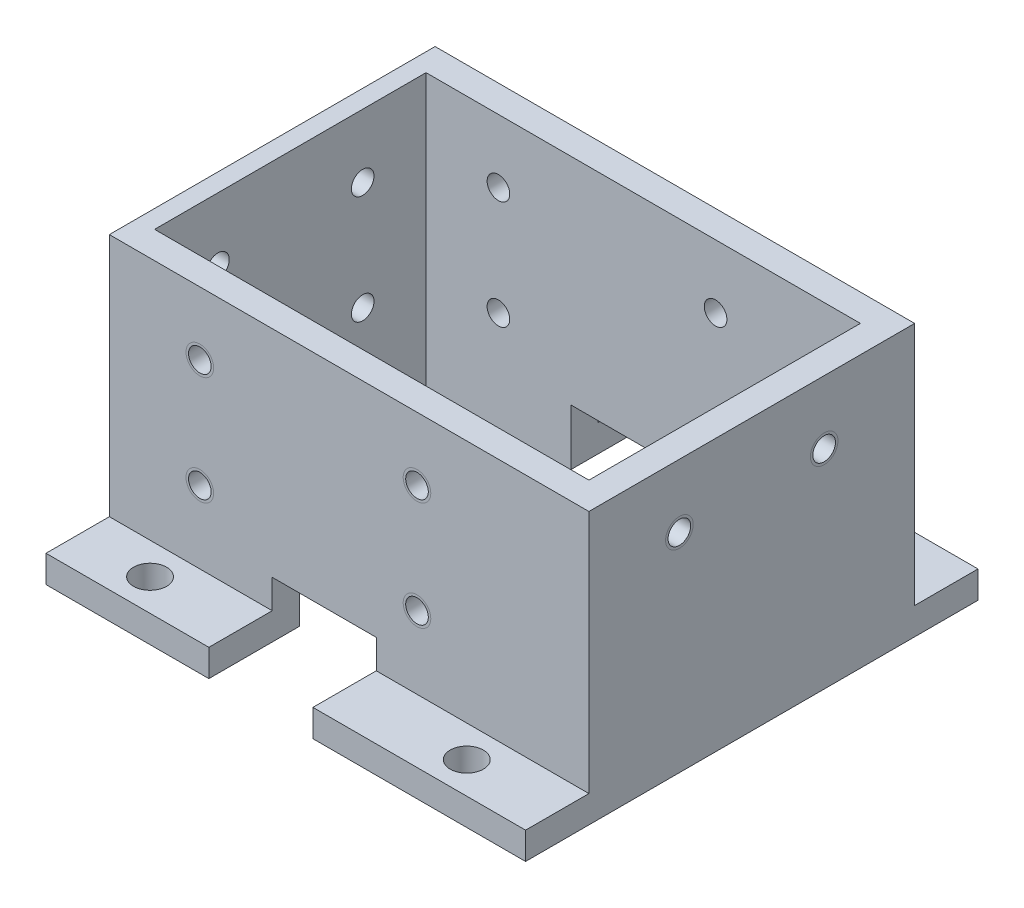
from build123d import *

# Parameters (mm, degrees)
SKETCH1_W                   = 36
SKETCH1_H                   = 38
BOSS_EXTRUDE2_DEPTH         = 53
SKETCH3_W                   = 30
SKETCH3_H                   = 35
CUT_EXTRUDE1_DEPTH          = 51
SKETCH4_W                   = 3
SKETCH4_H                   = 30
BOSS_EXTRUDE3_DEPTH         = 33
SKETCH5_W                   = 53
SKETCH5_H                   = 8
CUT_EXTRUDE2_DEPTH          = 52
SKETCH6_W                   = 53
SKETCH6_H                   = 7
BOSS_EXTRUDE4_DEPTH         = 3
CUT_EXTRUDE4_DEPTH          = 79.797208072
CUT_EXTRUDE4_DEPTH_BACK     = 79.797208072
SKETCH8_W                   = 11.5
SKETCH8_H                   = 3
M3_TAPPED_HOLE1_D           = 2.5
M3_TAPPED_HOLE1_DEPTH       = 3
M3_TAPPED_HOLE1_CSINK_D     = 3.05
M3_TAPPED_HOLE1_CSINK_ANGLE = 179
LPATTERN1_COUNT             = 2
LPATTERN1_PITCH             = 24
LPATTERN1_COUNT_DIR2        = 2
LPATTERN1_PITCH_DIR2        = 12
M3_TAPPED_HOLE2_D           = 2.5
M3_TAPPED_HOLE2_DEPTH       = 2
M3_TAPPED_HOLE2_CSINK_D     = 3.05
M3_TAPPED_HOLE2_CSINK_ANGLE = 179
LPATTERN2_COUNT             = 2
LPATTERN2_PITCH             = 16
LPATTERN2_COUNT_DIR2        = 2
LPATTERN2_PITCH_DIR2        = 12
M3_TAPPED_HOLE3_D           = 2.5
M3_TAPPED_HOLE3_CSINK_D     = 3.05
M3_TAPPED_HOLE3_CSINK_ANGLE = 179
LPATTERN3_COUNT             = 2
LPATTERN3_PITCH             = 16
M3_TAPPED_HOLE4_D           = 2.5
M3_TAPPED_HOLE4_CSINK_D     = 3.05
M3_TAPPED_HOLE4_CSINK_ANGLE = 179
LPATTERN4_COUNT             = 2
LPATTERN4_PITCH             = 24
LPATTERN4_COUNT_DIR2        = 2
LPATTERN4_PITCH_DIR2        = 12
SKETCH45_R                  = 1.833333333
CUT_EXTRUDE5_DEPTH          = 74.396185187
LPATTERN5_COUNT             = 2
LPATTERN5_PITCH             = 35
LPATTERN5_COUNT_DIR2        = 2
LPATTERN5_PITCH_DIR2        = 43
CUT_EXTRUDE6_DEPTH          = 75.551995278
CUT_EXTRUDE6_DEPTH_BACK     = 75.551995278
SKETCH46_W                  = 11.5
SKETCH46_H                  = 3.2


with BuildPart() as part:
    # Sketch1 → Boss-Extrude2 (new body)
    with BuildSketch(Plane(origin=(0, 0, 0), x_dir=(0, 0, -1), z_dir=(1, 0, 0))):
        with Locations((18, 19)):
            Rectangle(SKETCH1_W, SKETCH1_H)
    extrude(amount=BOSS_EXTRUDE2_DEPTH)

    # Sketch3 → Cut-Extrude1 (cut)
    with BuildSketch(Plane(origin=(53, 0, 0), x_dir=(0, 0, -1), z_dir=(1, 0, 0))):
        with Locations((18, 17.5)):
            Rectangle(SKETCH3_W, SKETCH3_H)
    extrude(amount=-CUT_EXTRUDE1_DEPTH, mode=Mode.SUBTRACT)

    # Sketch4 → Boss-Extrude3 (add)
    with BuildSketch(Plane.XY):
        with Locations((51.5, 15)):
            Rectangle(SKETCH4_W, SKETCH4_H)
    extrude(amount=-BOSS_EXTRUDE3_DEPTH)

    # Sketch5 → Cut-Extrude2 (cut)
    with BuildSketch(Plane.XY):
        with Locations((26.5, 34)):
            Rectangle(SKETCH5_W, SKETCH5_H)
    extrude(amount=-CUT_EXTRUDE2_DEPTH, mode=Mode.SUBTRACT)

    # Sketch6 → Boss-Extrude4 (add)
    with BuildSketch(Plane(origin=(0, 0, 0), x_dir=(-1, 0, 0), z_dir=(0, -1, 0))):
        with Locations((-26.5, -3.5)):
            Rectangle(SKETCH6_W, SKETCH6_H)
        with Locations((-26.5, 39.5)):
            Rectangle(SKETCH6_W, SKETCH6_H)
    extrude(amount=-BOSS_EXTRUDE4_DEPTH)

    # Sketch8 → Cut-Extrude4 (cut, two sides: drawn at the far end of the back side and taken through both)
    with BuildSketch(Plane(origin=(0, 0, -43), x_dir=(-1, 0, 0), z_dir=(0, 0, -1)).offset(-CUT_EXTRUDE4_DEPTH_BACK)):
        with Locations((-23.75, 1.5)):
            Rectangle(SKETCH8_W, SKETCH8_H)
    extrude(amount=CUT_EXTRUDE4_DEPTH + CUT_EXTRUDE4_DEPTH_BACK, mode=Mode.SUBTRACT)

    # M3 Tapped Hole1
    with Locations(Plane.XY):
        with Locations((10, 23)):
            m3_tapped_hole1 = CounterSinkHole(M3_TAPPED_HOLE1_D / 2, M3_TAPPED_HOLE1_CSINK_D / 2, depth=M3_TAPPED_HOLE1_DEPTH, counter_sink_angle=M3_TAPPED_HOLE1_CSINK_ANGLE)

    # LPattern1: M3 Tapped Hole1 2 × 2
    with Locations(*[(i * LPATTERN1_PITCH, -j * LPATTERN1_PITCH_DIR2, 0) for i in range(LPATTERN1_COUNT) for j in range(LPATTERN1_COUNT_DIR2) if (i, j) != (0, 0)]):
        add(m3_tapped_hole1, mode=Mode.SUBTRACT)

    # M3 Tapped Hole2
    with Locations(Plane.ZY):
        with Locations((-26, 23)):
            m3_tapped_hole2 = CounterSinkHole(M3_TAPPED_HOLE2_D / 2, M3_TAPPED_HOLE2_CSINK_D / 2, depth=M3_TAPPED_HOLE2_DEPTH, counter_sink_angle=M3_TAPPED_HOLE2_CSINK_ANGLE)

    # LPattern2: M3 Tapped Hole2 2 × 2
    with Locations(*[(0, -j * LPATTERN2_PITCH_DIR2, i * LPATTERN2_PITCH) for i in range(LPATTERN2_COUNT) for j in range(LPATTERN2_COUNT_DIR2) if (i, j) != (0, 0)]):
        add(m3_tapped_hole2, mode=Mode.SUBTRACT)

    # M3 Tapped Hole3 (through all)
    with Locations(Plane(origin=(53, 0, 0), x_dir=(0, 0, -1), z_dir=(1, 0, 0))):
        with Locations((26, 23)):
            m3_tapped_hole3 = CounterSinkHole(M3_TAPPED_HOLE3_D / 2, M3_TAPPED_HOLE3_CSINK_D / 2, counter_sink_angle=M3_TAPPED_HOLE3_CSINK_ANGLE)

    # LPattern3: M3 Tapped Hole3 ×2
    with Locations(*[(0, 0, i * LPATTERN3_PITCH) for i in range(1, LPATTERN3_COUNT)]):
        add(m3_tapped_hole3, mode=Mode.SUBTRACT)

    # M3 Tapped Hole4 (through all)
    with Locations(Plane(origin=(0, 0, -36), x_dir=(-1, 0, 0), z_dir=(0, 0, -1))):
        with Locations((-10, 23)):
            m3_tapped_hole4 = CounterSinkHole(M3_TAPPED_HOLE4_D / 2, M3_TAPPED_HOLE4_CSINK_D / 2, counter_sink_angle=M3_TAPPED_HOLE4_CSINK_ANGLE)

    # LPattern4: M3 Tapped Hole4 2 × 2
    with Locations(*[(i * LPATTERN4_PITCH, -j * LPATTERN4_PITCH_DIR2, 0) for i in range(LPATTERN4_COUNT) for j in range(LPATTERN4_COUNT_DIR2) if (i, j) != (0, 0)]):
        add(m3_tapped_hole4, mode=Mode.SUBTRACT)

    # Sketch45 → Cut-Extrude5 (cut, symmetric)
    with BuildSketch(Plane(origin=(0, 3, 0), x_dir=(1, 0, 0), z_dir=(0, 1, 0))):
        with Locations(Location((8, 39.5, 0), (0, 0, 270))):
            Circle(SKETCH45_R)
    cut_extrude5 = extrude(amount=CUT_EXTRUDE5_DEPTH, both=True, mode=Mode.SUBTRACT)

    # LPattern5: Cut-Extrude5 2 × 2
    with Locations(*[(i * LPATTERN5_PITCH, 0, j * LPATTERN5_PITCH_DIR2) for i in range(LPATTERN5_COUNT) for j in range(LPATTERN5_COUNT_DIR2) if (i, j) != (0, 0)]):
        add(cut_extrude5, mode=Mode.SUBTRACT)

    # Sketch46 → Cut-Extrude6 (cut, two sides: drawn at the far end of the back side and taken through both)
    with BuildSketch(Plane(origin=(0, 0, -36), x_dir=(-1, 0, 0), z_dir=(0, 0, -1)).offset(-CUT_EXTRUDE6_DEPTH_BACK)):
        with Locations((-23.75, 4.6)):
            Rectangle(SKETCH46_W, SKETCH46_H)
    extrude(amount=CUT_EXTRUDE6_DEPTH + CUT_EXTRUDE6_DEPTH_BACK, mode=Mode.SUBTRACT)


solid = part.part
